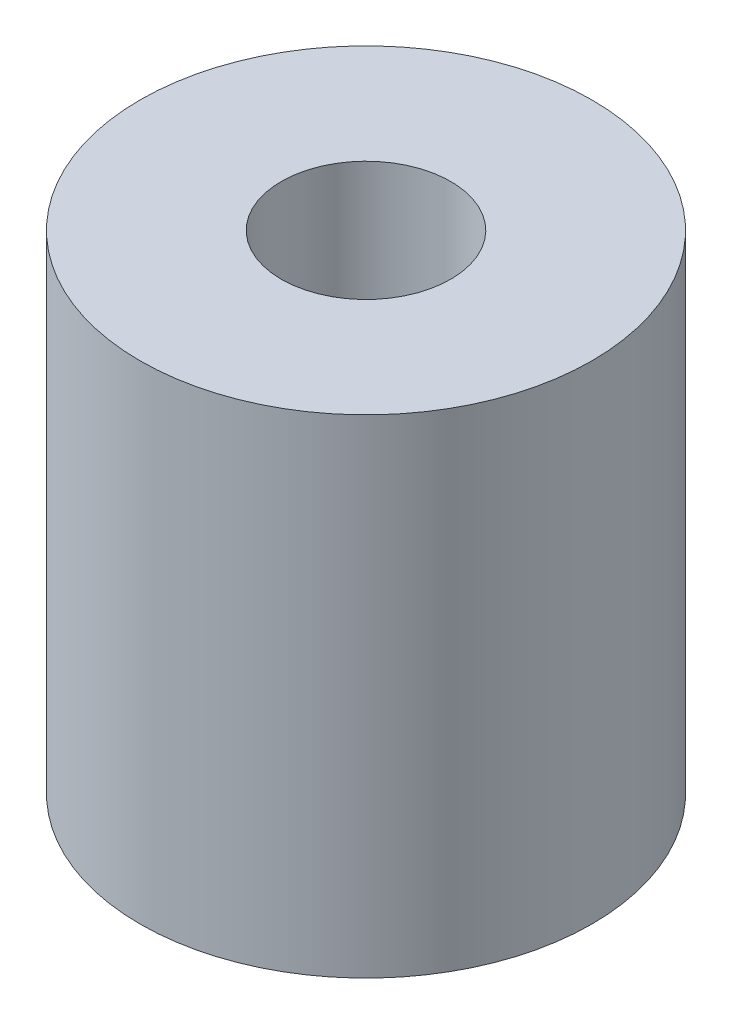
from build123d import *

# Parameters (mm, degrees)
SKETCH1_R           = 4.0000047
BOSS_EXTRUDE1_DEPTH = 8.636
SKETCH2_R           = 1.5
CUT_EXTRUDE1_DEPTH  = 7.62


with BuildPart() as part:
    # Sketch1 → Boss-Extrude1 (new body)
    with BuildSketch(Plane(origin=(0, 0, 0), x_dir=(1, 0, 0), z_dir=(0, 1, 0))):
        with Locations(Location((0, 0, 0), (0, 0, 270))):
            Circle(SKETCH1_R)
    extrude(amount=BOSS_EXTRUDE1_DEPTH)

    # Sketch2 → Cut-Extrude1 (cut)
    with BuildSketch(Plane(origin=(0, 8.636, 0), x_dir=(1, 0, 0), z_dir=(0, 1, 0))):
        with Locations(Location((0, 0, 0), (0, 0, 270))):
            Circle(SKETCH2_R)
    extrude(amount=-CUT_EXTRUDE1_DEPTH, mode=Mode.SUBTRACT)


solid = part.part
